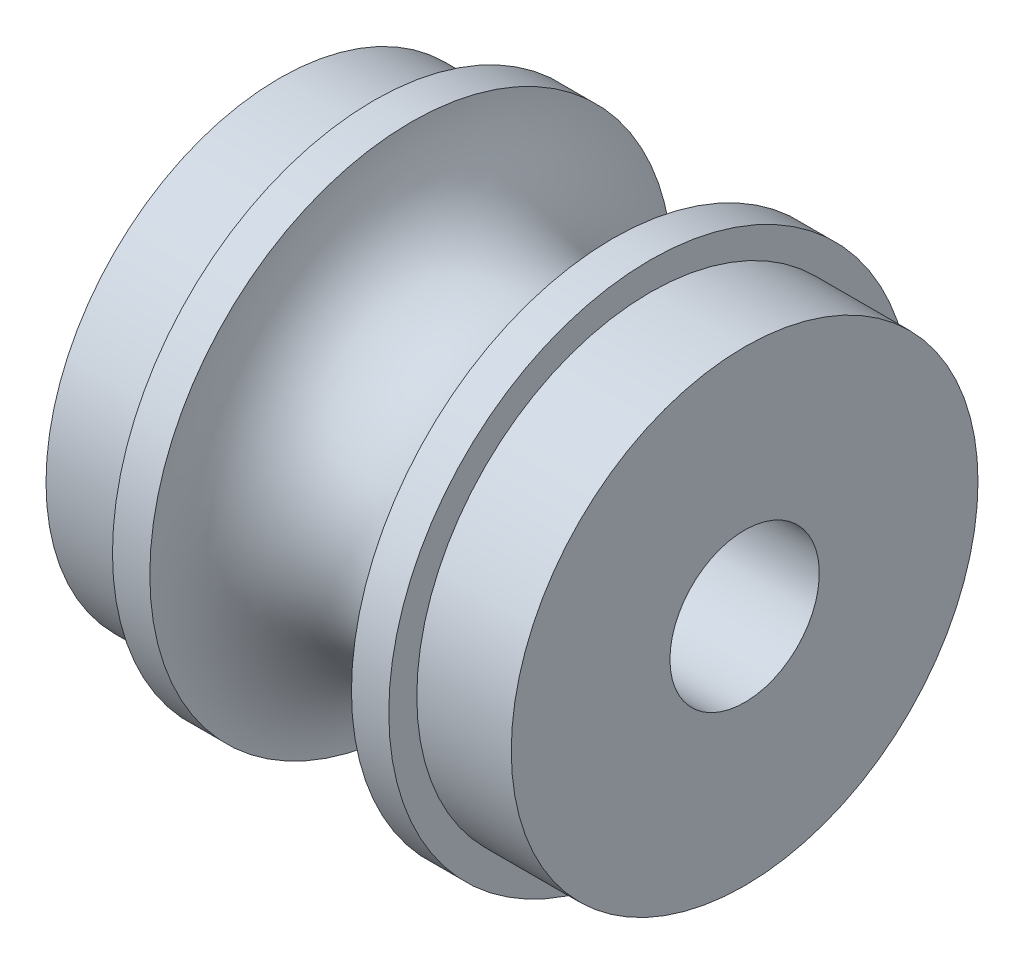
from build123d import *

# Parameters (mm, degrees)
SKETCH1_W           = 1.27
SKETCH1_H           = 8.89
SKETCH2_R           = 7.9375
BOSS_EXTRUDE1_DEPTH = 3.2131
BOSS_EXTRUDE2_START = 3.2131
SKETCH3_R           = 7.9375
BOSS_EXTRUDE2_DEPTH = 3.2131
SKETCH4_R           = 2.54
CUT_EXTRUDE1_DEPTH  = 21.210628532


with BuildPart() as part:
    # Sketch1 → Revolve1 (revolve)
    with BuildSketch(Plane.XY, mode=Mode.PRIVATE) as revolve1_sk:
        with BuildLine():
            ThreePointArc((0, 8.89), (3.429, 5.461), (6.858, 8.89))
            Line((6.858, 8.89), (6.858, 0))
            Line((6.858, 0), (0, 0))
            Line((0, 0), (0, 8.89))
        make_face()
        with Locations((-0.635, 4.445)):
            Rectangle(SKETCH1_W, SKETCH1_H)
        with Locations((7.493, 4.445)):
            Rectangle(SKETCH1_W, SKETCH1_H)
    revolve(revolve1_sk.sketch.rotate(Axis((0, 0, 0), (1, 0, 0)), 90), axis=Axis((0, 0, 0), (1, 0, 0)))

    # Sketch2 → Boss-Extrude1 (add)
    with BuildSketch(Plane(origin=(8.128, 0, 0), x_dir=(0, 0, -1), z_dir=(1, 0, 0))):
        Circle(SKETCH2_R)
    extrude(amount=BOSS_EXTRUDE1_DEPTH)

    # Sketch3 → Boss-Extrude2 (add)
    with BuildSketch(Plane.ZY.offset(1.27).offset(BOSS_EXTRUDE2_START)):
        with Locations(Location((0, 0, 0), (0, 0, 180))):
            Circle(SKETCH3_R)
    extrude(amount=-BOSS_EXTRUDE2_DEPTH)

    # Sketch4 → Cut-Extrude1 (cut, through all)
    with BuildSketch(Plane.ZY.offset(4.4831)):
        Circle(SKETCH4_R)
    extrude(amount=-CUT_EXTRUDE1_DEPTH, mode=Mode.SUBTRACT)


solid = part.part
